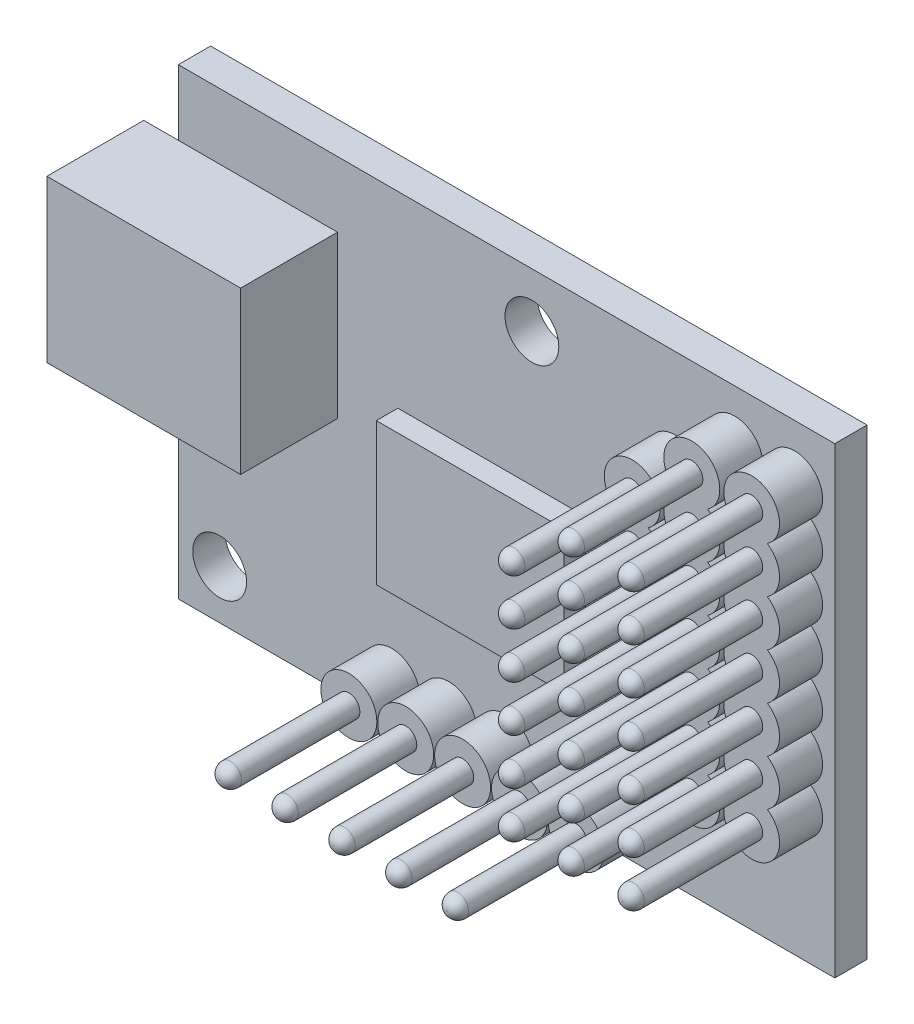
from build123d import *

# Parameters (mm, degrees)
ESQUISSE1_R             = 0.513538018
BOSS_EXTRU_6_DEPTH      = 9.5
BOSS_EXTRU_6_2_DEPTH    = 9.5
BOSS_EXTRU_6_3_DEPTH    = 9.5
BOSS_EXTRU_6_4_DEPTH    = 9.5
BOSS_EXTRU_6_5_DEPTH    = 9.5
BOSS_EXTRU_6_6_DEPTH    = 9.5
BOSS_EXTRU_6_7_DEPTH    = 9.5
BOSS_EXTRU_6_8_DEPTH    = 9.5
BOSS_EXTRU_6_9_DEPTH    = 9.5
BOSS_EXTRU_6_10_DEPTH   = 9.5
BOSS_EXTRU_6_11_DEPTH   = 9.5
BOSS_EXTRU_6_12_DEPTH   = 9.5
BOSS_EXTRU_6_13_DEPTH   = 9.5
BOSS_EXTRU_6_14_DEPTH   = 9.5
BOSS_EXTRU_6_15_DEPTH   = 9.5
BOSS_EXTRU_6_16_DEPTH   = 9.5
BOSS_EXTRU_6_17_DEPTH   = 9.5
BOSS_EXTRU_6_18_DEPTH   = 9.5
BOSS_EXTRU_6_19_DEPTH   = 9.5
BOSS_EXTRU_6_20_DEPTH   = 9.5
BOSS_EXTRU_6_21_DEPTH   = 9.5
BOSS_EXTRU_6_22_DEPTH   = 9.5
BOSS_EXTRU_6_23_DEPTH   = 9.5
BOSS_EXTRU_6_24_DEPTH   = 9.5
BOSS_EXTRU_6_25_DEPTH   = 9.5
ESQUISSE1_3_R           = 1.3
ESQUISSE1_3_R_2         = 0.513538018
BOSS_EXTRU_7_DEPTH      = 3.5
ESQUISSE1_4_R           = 1.25
ESQUISSE1_4_R_2         = 1.3
BOSS_EXTRU_8_DEPTH      = 1.5
ESQUISSE1_5_W           = 9
ESQUISSE1_5_H           = 7.5
BOSS_EXTRU_9_DEPTH      = 6
ESQUISSE2_W             = 1.60536084
ESQUISSE2_H             = 1.5
ENL_V_MAT_EXTRU_1_DEPTH = 10
CONG_1_R                = 0.5
ESQUISSE3_W             = 0.825274796
ESQUISSE3_H             = 3.470317893
ENL_V_MAT_EXTRU_2_DEPTH = 8
ESQUISSE4_W             = 8.729762098
ESQUISSE4_H             = 6.604234571
BOSS_EXTRU_10_DEPTH     = 1


with BuildPart() as part:
    # Esquisse1 → Boss.-Extru.6 (new body)
    with BuildSketch(Plane.XY):
        with Locations((10.605583884, 8.235861117)):
            Circle(ESQUISSE1_R)
    extrude(amount=BOSS_EXTRU_6_DEPTH)



with BuildPart() as body_2:
    # Esquisse1 → Boss.-Extru.6 2 (new body)
    with BuildSketch(Plane.XY):
        with Locations((13.389344642, 8.235861117)):
            Circle(ESQUISSE1_R)
    extrude(amount=BOSS_EXTRU_6_2_DEPTH)


with BuildPart() as body_3:
    # Esquisse1 → Boss.-Extru.6 3 (new body)
    with BuildSketch(Plane.XY):
        with Locations((7.841442948, 6.095861117)):
            Circle(ESQUISSE1_R)
    extrude(amount=BOSS_EXTRU_6_3_DEPTH)


with BuildPart() as body_4:
    # Esquisse1 → Boss.-Extru.6 4 (new body)
    with BuildSketch(Plane.XY):
        with Locations((10.605583884, 6.095861117)):
            Circle(ESQUISSE1_R)
    extrude(amount=BOSS_EXTRU_6_4_DEPTH)


with BuildPart() as body_5:
    # Esquisse1 → Boss.-Extru.6 5 (new body)
    with BuildSketch(Plane.XY):
        with Locations((13.389344642, 6.095861117)):
            Circle(ESQUISSE1_R)
    extrude(amount=BOSS_EXTRU_6_5_DEPTH)


with BuildPart() as body_6:
    # Esquisse1 → Boss.-Extru.6 6 (new body)
    with BuildSketch(Plane.XY):
        with Locations((7.841442948, 3.955861117)):
            Circle(ESQUISSE1_R)
    extrude(amount=BOSS_EXTRU_6_6_DEPTH)


with BuildPart() as body_7:
    # Esquisse1 → Boss.-Extru.6 7 (new body)
    with BuildSketch(Plane.XY):
        with Locations((10.605583884, 3.955861117)):
            Circle(ESQUISSE1_R)
    extrude(amount=BOSS_EXTRU_6_7_DEPTH)


with BuildPart() as body_8:
    # Esquisse1 → Boss.-Extru.6 8 (new body)
    with BuildSketch(Plane.XY):
        with Locations((13.389344642, 3.955861117)):
            Circle(ESQUISSE1_R)
    extrude(amount=BOSS_EXTRU_6_8_DEPTH)


with BuildPart() as body_9:
    # Esquisse1 → Boss.-Extru.6 9 (new body)
    with BuildSketch(Plane.XY):
        with Locations((7.841442948, 1.815861117)):
            Circle(ESQUISSE1_R)
    extrude(amount=BOSS_EXTRU_6_9_DEPTH)


with BuildPart() as body_10:
    # Esquisse1 → Boss.-Extru.6 10 (new body)
    with BuildSketch(Plane.XY):
        with Locations((10.605583884, 1.815861117)):
            Circle(ESQUISSE1_R)
    extrude(amount=BOSS_EXTRU_6_10_DEPTH)


with BuildPart() as body_11:
    # Esquisse1 → Boss.-Extru.6 11 (new body)
    with BuildSketch(Plane.XY):
        with Locations((13.389344642, 1.815861117)):
            Circle(ESQUISSE1_R)
    extrude(amount=BOSS_EXTRU_6_11_DEPTH)


with BuildPart() as body_12:
    # Esquisse1 → Boss.-Extru.6 12 (new body)
    with BuildSketch(Plane.XY):
        with Locations((7.841442948, -0.324138883)):
            Circle(ESQUISSE1_R)
    extrude(amount=BOSS_EXTRU_6_12_DEPTH)


with BuildPart() as body_13:
    # Esquisse1 → Boss.-Extru.6 13 (new body)
    with BuildSketch(Plane.XY):
        with Locations((10.605583884, -0.324138883)):
            Circle(ESQUISSE1_R)
    extrude(amount=BOSS_EXTRU_6_13_DEPTH)


with BuildPart() as body_14:
    # Esquisse1 → Boss.-Extru.6 14 (new body)
    with BuildSketch(Plane.XY):
        with Locations((13.389344642, -0.324138883)):
            Circle(ESQUISSE1_R)
    extrude(amount=BOSS_EXTRU_6_14_DEPTH)


with BuildPart() as body_15:
    # Esquisse1 → Boss.-Extru.6 15 (new body)
    with BuildSketch(Plane.XY):
        with Locations((7.841442948, -2.464138883)):
            Circle(ESQUISSE1_R)
    extrude(amount=BOSS_EXTRU_6_15_DEPTH)


with BuildPart() as body_16:
    # Esquisse1 → Boss.-Extru.6 16 (new body)
    with BuildSketch(Plane.XY):
        with Locations((10.605583884, -2.464138883)):
            Circle(ESQUISSE1_R)
    extrude(amount=BOSS_EXTRU_6_16_DEPTH)


with BuildPart() as body_17:
    # Esquisse1 → Boss.-Extru.6 17 (new body)
    with BuildSketch(Plane.XY):
        with Locations((13.389344642, -2.464138883)):
            Circle(ESQUISSE1_R)
    extrude(amount=BOSS_EXTRU_6_17_DEPTH)


with BuildPart() as body_18:
    # Esquisse1 → Boss.-Extru.6 18 (new body)
    with BuildSketch(Plane.XY):
        with Locations((7.841442948, -4.604138883)):
            Circle(ESQUISSE1_R)
    extrude(amount=BOSS_EXTRU_6_18_DEPTH)


with BuildPart() as body_19:
    # Esquisse1 → Boss.-Extru.6 19 (new body)
    with BuildSketch(Plane.XY):
        with Locations((10.605583884, -4.604138883)):
            Circle(ESQUISSE1_R)
    extrude(amount=BOSS_EXTRU_6_19_DEPTH)


with BuildPart() as body_20:
    # Esquisse1 → Boss.-Extru.6 20 (new body)
    with BuildSketch(Plane.XY):
        with Locations((13.389344642, -4.604138883)):
            Circle(ESQUISSE1_R)
    extrude(amount=BOSS_EXTRU_6_20_DEPTH)


with BuildPart() as body_21:
    # Esquisse1 → Boss.-Extru.6 21 (new body)
    with BuildSketch(Plane.XY):
        with Locations((2.6, -9.079624134)):
            Circle(ESQUISSE1_R)
    extrude(amount=BOSS_EXTRU_6_21_DEPTH)


with BuildPart() as body_22:
    # Esquisse1 → Boss.-Extru.6 22 (new body)
    with BuildSketch(Plane.XY):
        with Locations((-2.684583193, -9.088622927)):
            Circle(ESQUISSE1_R)
    extrude(amount=BOSS_EXTRU_6_22_DEPTH)


with BuildPart() as body_23:
    # Esquisse1 → Boss.-Extru.6 23 (new body)
    with BuildSketch(Plane.XY):
        with Locations((-5.326789442, -9.078688178)):
            Circle(ESQUISSE1_R)
    extrude(amount=BOSS_EXTRU_6_23_DEPTH)


with BuildPart() as body_24:
    # Esquisse1 → Boss.-Extru.6 24 (new body)
    with BuildSketch(Plane.XY):
        with Locations((-0.041910668, -9.08348076)):
            Circle(ESQUISSE1_R)
    extrude(amount=BOSS_EXTRU_6_24_DEPTH)


with BuildPart() as body_25:
    # Esquisse1 → Boss.-Extru.6 25 (new body)
    with BuildSketch(Plane.XY):
        with Locations((5.228702302, -9.069339799)):
            Circle(ESQUISSE1_R)
    extrude(amount=BOSS_EXTRU_6_25_DEPTH)


with BuildPart() as part_1:
    add(part.part)

    add(body_2.part)  # Boss.-Extru.7 merges body 2

    add(body_3.part)  # Boss.-Extru.7 merges body 3

    add(body_4.part)  # Boss.-Extru.7 merges body 4

    add(body_5.part)  # Boss.-Extru.7 merges body 5

    add(body_6.part)  # Boss.-Extru.7 merges body 6

    add(body_7.part)  # Boss.-Extru.7 merges body 7

    add(body_8.part)  # Boss.-Extru.7 merges body 8

    add(body_9.part)  # Boss.-Extru.7 merges body 9

    add(body_10.part)  # Boss.-Extru.7 merges body 10

    add(body_11.part)  # Boss.-Extru.7 merges body 11

    add(body_12.part)  # Boss.-Extru.7 merges body 12

    add(body_13.part)  # Boss.-Extru.7 merges body 13

    add(body_14.part)  # Boss.-Extru.7 merges body 14

    add(body_15.part)  # Boss.-Extru.7 merges body 15

    add(body_16.part)  # Boss.-Extru.7 merges body 16

    add(body_17.part)  # Boss.-Extru.7 merges body 17

    add(body_18.part)  # Boss.-Extru.7 merges body 18

    add(body_19.part)  # Boss.-Extru.7 merges body 19

    add(body_20.part)  # Boss.-Extru.7 merges body 20

    add(body_21.part)  # Boss.-Extru.7 merges body 21

    add(body_22.part)  # Boss.-Extru.7 merges body 22

    add(body_23.part)  # Boss.-Extru.7 merges body 23

    add(body_24.part)  # Boss.-Extru.7 merges body 24

    add(body_25.part)  # Boss.-Extru.7 merges body 25
    # Esquisse1<3> → Boss.-Extru.7 (add)
    # profile 1 of 8: a face of its own
    with BuildSketch(Plane.XY):
        with Locations((-5.326789442, -9.078688178)):
            Circle(ESQUISSE1_3_R)
        with Locations((-5.326789442, -9.078688178)):
            Circle(ESQUISSE1_3_R_2, mode=Mode.SUBTRACT)
    # profile 2 of 8: a face of its own
    with BuildSketch(Plane.XY):
        with BuildLine():
            ThreePointArc((8.579751827, 2.885861117), (9.141442948, 3.955861117), (8.579751827, 5.025861117))
            ThreePointArc((8.579751827, 5.025861117), (7.841442948, 7.395861117), (7.10313407, 5.025861117))
            ThreePointArc((7.10313407, 5.025861117), (6.541442948, 3.955861117), (7.10313407, 2.885861117))
            ThreePointArc((7.10313407, 2.885861117), (6.541442948, 1.815861117), (7.10313407, 0.745861117))
            ThreePointArc((7.10313407, 0.745861117), (6.541442948, -0.324138883), (7.10313407, -1.394138883))
            ThreePointArc((7.10313407, -1.394138883), (6.541442948, -2.464138883), (7.10313407, -3.534138883))
            ThreePointArc((7.10313407, -3.534138883), (7.841442948, -5.904138883), (8.579751827, -3.534138883))
            ThreePointArc((8.579751827, -3.534138883), (9.141442948, -2.464138883), (8.579751827, -1.394138883))
            ThreePointArc((8.579751827, -1.394138883), (9.141442948, -0.324138883), (8.579751827, 0.745861117))
            ThreePointArc((8.579751827, 0.745861117), (9.141442948, 1.815861117), (8.579751827, 2.885861117))
        make_face()
        with Locations((7.841442948, -4.604138883)):
            Circle(ESQUISSE1_3_R_2, mode=Mode.SUBTRACT)
        with Locations((7.841442948, -2.464138883)):
            Circle(ESQUISSE1_3_R_2, mode=Mode.SUBTRACT)
        with Locations((7.841442948, -0.324138883)):
            Circle(ESQUISSE1_3_R_2, mode=Mode.SUBTRACT)
        with Locations((7.841442948, 1.815861117)):
            Circle(ESQUISSE1_3_R_2, mode=Mode.SUBTRACT)
        with Locations((7.841442948, 3.955861117)):
            Circle(ESQUISSE1_3_R_2, mode=Mode.SUBTRACT)
        with Locations((7.841442948, 6.095861117)):
            Circle(ESQUISSE1_3_R_2, mode=Mode.SUBTRACT)
    # profile 3 of 8: a face of its own
    with BuildSketch(Plane.XY):
        with BuildLine():
            ThreePointArc((11.343892763, 2.885861117), (11.905583884, 3.955861117), (11.343892763, 5.025861117))
            ThreePointArc((11.343892763, 5.025861117), (11.905583884, 6.095861117), (11.343892763, 7.165861117))
            ThreePointArc((11.343892763, 7.165861117), (10.605583884, 9.535861117), (9.867275006, 7.165861117))
            ThreePointArc((9.867275006, 7.165861117), (9.305583884, 6.095861117), (9.867275006, 5.025861117))
            ThreePointArc((9.867275006, 5.025861117), (9.305583884, 3.955861117), (9.867275006, 2.885861117))
            ThreePointArc((9.867275006, 2.885861117), (9.305583884, 1.815861117), (9.867275006, 0.745861117))
            ThreePointArc((9.867275006, 0.745861117), (9.305583884, -0.324138883), (9.867275006, -1.394138883))
            ThreePointArc((9.867275006, -1.394138883), (9.305583884, -2.464138883), (9.867275006, -3.534138883))
            ThreePointArc((9.867275006, -3.534138883), (10.605583884, -5.904138883), (11.343892763, -3.534138883))
            ThreePointArc((11.343892763, -3.534138883), (11.905583884, -2.464138883), (11.343892763, -1.394138883))
            ThreePointArc((11.343892763, -1.394138883), (11.905583884, -0.324138883), (11.343892763, 0.745861117))
            ThreePointArc((11.343892763, 0.745861117), (11.905583884, 1.815861117), (11.343892763, 2.885861117))
        make_face()
        with Locations((10.605583884, -4.604138883)):
            Circle(ESQUISSE1_3_R_2, mode=Mode.SUBTRACT)
        with Locations((10.605583884, -2.464138883)):
            Circle(ESQUISSE1_3_R_2, mode=Mode.SUBTRACT)
        with Locations((10.605583884, -0.324138883)):
            Circle(ESQUISSE1_3_R_2, mode=Mode.SUBTRACT)
        with Locations((10.605583884, 1.815861117)):
            Circle(ESQUISSE1_3_R_2, mode=Mode.SUBTRACT)
        with Locations((10.605583884, 3.955861117)):
            Circle(ESQUISSE1_3_R_2, mode=Mode.SUBTRACT)
        with Locations((10.605583884, 6.095861117)):
            Circle(ESQUISSE1_3_R_2, mode=Mode.SUBTRACT)
        with Locations((10.605583884, 8.235861117)):
            Circle(ESQUISSE1_3_R_2, mode=Mode.SUBTRACT)
    # profile 4 of 8: a face of its own
    with BuildSketch(Plane.XY):
        with BuildLine():
            ThreePointArc((14.115961969, 2.885861117), (14.682740459, 3.955861117), (14.115961969, 5.025861117))
            ThreePointArc((14.115961969, 5.025861117), (14.682740459, 6.095861117), (14.115961969, 7.165861117))
            ThreePointArc((14.115961969, 7.165861117), (13.389344642, 9.529256934), (12.662727315, 7.165861117))
            ThreePointArc((12.662727315, 7.165861117), (12.095948825, 6.095861117), (12.662727315, 5.025861117))
            ThreePointArc((12.662727315, 5.025861117), (12.095948825, 3.955861117), (12.662727315, 2.885861117))
            ThreePointArc((12.662727315, 2.885861117), (12.095948825, 1.815861117), (12.662727315, 0.745861117))
            ThreePointArc((12.662727315, 0.745861117), (12.095948825, -0.324138883), (12.662727315, -1.394138883))
            ThreePointArc((12.662727315, -1.394138883), (12.095948825, -2.464138883), (12.662727315, -3.534138883))
            ThreePointArc((12.662727315, -3.534138883), (13.389344642, -5.8975347), (14.115961969, -3.534138883))
            ThreePointArc((14.115961969, -3.534138883), (14.682740459, -2.464138883), (14.115961969, -1.394138883))
            ThreePointArc((14.115961969, -1.394138883), (14.682740459, -0.324138883), (14.115961969, 0.745861117))
            ThreePointArc((14.115961969, 0.745861117), (14.682740459, 1.815861117), (14.115961969, 2.885861117))
        make_face()
        with Locations((13.389344642, -4.604138883)):
            Circle(ESQUISSE1_3_R_2, mode=Mode.SUBTRACT)
        with Locations((13.389344642, -2.464138883)):
            Circle(ESQUISSE1_3_R_2, mode=Mode.SUBTRACT)
        with Locations((13.389344642, -0.324138883)):
            Circle(ESQUISSE1_3_R_2, mode=Mode.SUBTRACT)
        with Locations((13.389344642, 1.815861117)):
            Circle(ESQUISSE1_3_R_2, mode=Mode.SUBTRACT)
        with Locations((13.389344642, 3.955861117)):
            Circle(ESQUISSE1_3_R_2, mode=Mode.SUBTRACT)
        with Locations((13.389344642, 6.095861117)):
            Circle(ESQUISSE1_3_R_2, mode=Mode.SUBTRACT)
        with Locations((13.389344642, 8.235861117)):
            Circle(ESQUISSE1_3_R_2, mode=Mode.SUBTRACT)
    # profile 5 of 8: a face of its own
    with BuildSketch(Plane.XY):
        with Locations((5.228702302, -9.069339799)):
            Circle(ESQUISSE1_3_R)
        with Locations((5.228702302, -9.069339799)):
            Circle(ESQUISSE1_3_R_2, mode=Mode.SUBTRACT)
    # profile 6 of 8: a face of its own
    with BuildSketch(Plane.XY):
        with Locations((2.6, -9.079624134)):
            Circle(ESQUISSE1_3_R)
        with Locations((2.6, -9.079624134)):
            Circle(ESQUISSE1_3_R_2, mode=Mode.SUBTRACT)
    # profile 7 of 8: a face of its own
    with BuildSketch(Plane.XY):
        with Locations((-0.041910668, -9.08348076)):
            Circle(ESQUISSE1_3_R)
        with Locations((-0.041910668, -9.08348076)):
            Circle(ESQUISSE1_3_R_2, mode=Mode.SUBTRACT)
    # profile 8 of 8: a face of its own
    with BuildSketch(Plane.XY):
        with Locations((-2.684583193, -9.088622927)):
            Circle(ESQUISSE1_3_R)
        with Locations((-2.684583193, -9.088622927)):
            Circle(ESQUISSE1_3_R_2, mode=Mode.SUBTRACT)
    extrude(amount=BOSS_EXTRU_7_DEPTH)

    # Esquisse1<4> → Boss.-Extru.8 (add)
    with BuildSketch(Plane.XY):
        Polygon((-15.25, -10.75), (15.25, -10.75), (15.25, 10.75), (-15.25, 10.75), (-15.25, 7.705861117), (-7.85536084, 7.705861117), (-7.85536084, 0.205861117), (-15.25, 0.205861117), align=None)
        with Locations((-13.330640463, -8.488058683)):
            Circle(ESQUISSE1_4_R, mode=Mode.SUBTRACT)
        with Locations((-5.326789442, -9.078688178)):
            Circle(ESQUISSE1_4_R_2, mode=Mode.SUBTRACT)
        with Locations((-2.684583193, -9.088622927)):
            Circle(ESQUISSE1_4_R_2, mode=Mode.SUBTRACT)
        with Locations((-0.041910668, -9.08348076)):
            Circle(ESQUISSE1_4_R_2, mode=Mode.SUBTRACT)
        with Locations((2.6, -9.079624134)):
            Circle(ESQUISSE1_4_R_2, mode=Mode.SUBTRACT)
        with Locations((5.228702302, -9.069339799)):
            Circle(ESQUISSE1_4_R_2, mode=Mode.SUBTRACT)
        with BuildLine():
            ThreePointArc((7.10313407, 5.025861117), (7.841442948, 7.395861117), (8.579751827, 5.025861117))
            ThreePointArc((8.579751827, 5.025861117), (9.141442948, 3.955861117), (8.579751827, 2.885861117))
            ThreePointArc((8.579751827, 2.885861117), (9.141442948, 1.815861117), (8.579751827, 0.745861117))
            ThreePointArc((8.579751827, 0.745861117), (9.141442948, -0.324138883), (8.579751827, -1.394138883))
            ThreePointArc((8.579751827, -1.394138883), (9.141442948, -2.464138883), (8.579751827, -3.534138883))
            ThreePointArc((8.579751827, -3.534138883), (7.841442948, -5.904138883), (7.10313407, -3.534138883))
            ThreePointArc((7.10313407, -3.534138883), (6.541442948, -2.464138883), (7.10313407, -1.394138883))
            ThreePointArc((7.10313407, -1.394138883), (6.541442948, -0.324138883), (7.10313407, 0.745861117))
            ThreePointArc((7.10313407, 0.745861117), (6.541442948, 1.815861117), (7.10313407, 2.885861117))
            ThreePointArc((7.10313407, 2.885861117), (6.541442948, 3.955861117), (7.10313407, 5.025861117))
        make_face(mode=Mode.SUBTRACT)
        with BuildLine():
            ThreePointArc((11.343892763, 7.165861117), (11.905583884, 6.095861117), (11.343892763, 5.025861117))
            ThreePointArc((11.343892763, 5.025861117), (11.905583884, 3.955861117), (11.343892763, 2.885861117))
            ThreePointArc((11.343892763, 2.885861117), (11.905583884, 1.815861117), (11.343892763, 0.745861117))
            ThreePointArc((11.343892763, 0.745861117), (11.905583884, -0.324138883), (11.343892763, -1.394138883))
            ThreePointArc((11.343892763, -1.394138883), (11.905583884, -2.464138883), (11.343892763, -3.534138883))
            ThreePointArc((11.343892763, -3.534138883), (10.605583884, -5.904138883), (9.867275006, -3.534138883))
            ThreePointArc((9.867275006, -3.534138883), (9.305583884, -2.464138883), (9.867275006, -1.394138883))
            ThreePointArc((9.867275006, -1.394138883), (9.305583884, -0.324138883), (9.867275006, 0.745861117))
            ThreePointArc((9.867275006, 0.745861117), (9.305583884, 1.815861117), (9.867275006, 2.885861117))
            ThreePointArc((9.867275006, 2.885861117), (9.305583884, 3.955861117), (9.867275006, 5.025861117))
            ThreePointArc((9.867275006, 5.025861117), (9.305583884, 6.095861117), (9.867275006, 7.165861117))
            ThreePointArc((9.867275006, 7.165861117), (10.605583884, 9.535861117), (11.343892763, 7.165861117))
        make_face(mode=Mode.SUBTRACT)
        with BuildLine():
            ThreePointArc((14.115961969, 7.165861117), (14.682740459, 6.095861117), (14.115961969, 5.025861117))
            ThreePointArc((14.115961969, 5.025861117), (14.682740459, 3.955861117), (14.115961969, 2.885861117))
            ThreePointArc((14.115961969, 2.885861117), (14.682740459, 1.815861117), (14.115961969, 0.745861117))
            ThreePointArc((14.115961969, 0.745861117), (14.682740459, -0.324138883), (14.115961969, -1.394138883))
            ThreePointArc((14.115961969, -1.394138883), (14.682740459, -2.464138883), (14.115961969, -3.534138883))
            ThreePointArc((14.115961969, -3.534138883), (13.389344642, -5.8975347), (12.662727315, -3.534138883))
            ThreePointArc((12.662727315, -3.534138883), (12.095948825, -2.464138883), (12.662727315, -1.394138883))
            ThreePointArc((12.662727315, -1.394138883), (12.095948825, -0.324138883), (12.662727315, 0.745861117))
            ThreePointArc((12.662727315, 0.745861117), (12.095948825, 1.815861117), (12.662727315, 2.885861117))
            ThreePointArc((12.662727315, 2.885861117), (12.095948825, 3.955861117), (12.662727315, 5.025861117))
            ThreePointArc((12.662727315, 5.025861117), (12.095948825, 6.095861117), (12.662727315, 7.165861117))
            ThreePointArc((12.662727315, 7.165861117), (13.389344642, 9.529256934), (14.115961969, 7.165861117))
        make_face(mode=Mode.SUBTRACT)
        with Locations((1.176643919, 8.235861117)):
            Circle(ESQUISSE1_4_R, mode=Mode.SUBTRACT)
    extrude(amount=BOSS_EXTRU_8_DEPTH)

    # Esquisse1<5> → Boss.-Extru.9 (add)
    with BuildSketch(Plane.XY):
        with Locations((-12.35536084, 3.955861117)):
            Rectangle(ESQUISSE1_5_W, ESQUISSE1_5_H)
    extrude(amount=BOSS_EXTRU_9_DEPTH)

    # Esquisse2 → Enlèv. mat.-Extru.1 (cut)
    with BuildSketch(Plane(origin=(0, 7.705861117, 0), x_dir=(1, 0, 0), z_dir=(0, 1, 0))):
        with Locations((-16.05268042, -0.75)):
            Rectangle(ESQUISSE2_W, ESQUISSE2_H)
    extrude(amount=-ENL_V_MAT_EXTRU_1_DEPTH, mode=Mode.SUBTRACT)

    # Congé1
    cong_1_edges = [part_1.edges().sort_by_distance(p)[0] for p in [
        (12.875806624, 1.815861117, 9.5),
        (-5.84032746, -9.078688178, 9.5),
        (-3.198121211, -9.088622927, 9.5),
        (-0.555448686, -9.08348076, 9.5),
        (2.086461982, -9.079624134, 9.5),
        (4.715164284, -9.069339799, 9.5),
        (12.875806624, -4.604138883, 9.5),
        (12.875806624, -2.464138883, 9.5),
        (10.092045866, -2.464138883, 9.5),
        (10.092045866, -4.604138883, 9.5),
        (7.32790493, -4.604138883, 9.5),
        (7.32790493, -2.464138883, 9.5),
        (7.32790493, -0.324138883, 9.5),
        (10.092045866, -0.324138883, 9.5),
        (12.875806624, -0.324138883, 9.5),
        (12.875806624, 3.955861117, 9.5),
        (10.092045866, 1.815861117, 9.5),
        (7.32790493, 1.815861117, 9.5),
        (7.32790493, 3.955861117, 9.5),
        (10.092045866, 3.955861117, 9.5),
        (10.092045866, 6.095861117, 9.5),
        (12.875806624, 6.095861117, 9.5),
        (12.875806624, 8.235861117, 9.5),
        (10.092045866, 8.235861117, 9.5),
        (7.32790493, 6.095861117, 9.5),
    ]]
    fillet(cong_1_edges, radius=CONG_1_R)

    # Esquisse3 → Enlèv. mat.-Extru.2 (cut)
    with BuildSketch(Plane.ZY.offset(16.85536084)):
        Polygon((5.507144096, 7.009957039), (5.507144096, 0.753430554), (4.211531949, 0.753430554), (3.167445781, 1.811190838), (2.11713817, 1.811190838), (2.11713817, 5.995151261), (3.167445781, 5.995151261), (4.211531949, 7.025740083), align=None)
        with Locations((3.167445781, 3.871526546)):
            Rectangle(ESQUISSE3_W, ESQUISSE3_H, mode=Mode.SUBTRACT)
    extrude(amount=-ENL_V_MAT_EXTRU_2_DEPTH, mode=Mode.SUBTRACT)

    # Esquisse4 → Boss.-Extru.10 (add)
    with BuildSketch(Plane.XY.offset(1.5)):
        with Locations((-0.686554395, -1.275665216)):
            Rectangle(ESQUISSE4_W, ESQUISSE4_H)
    extrude(amount=BOSS_EXTRU_10_DEPTH)


solid = part_1.part
